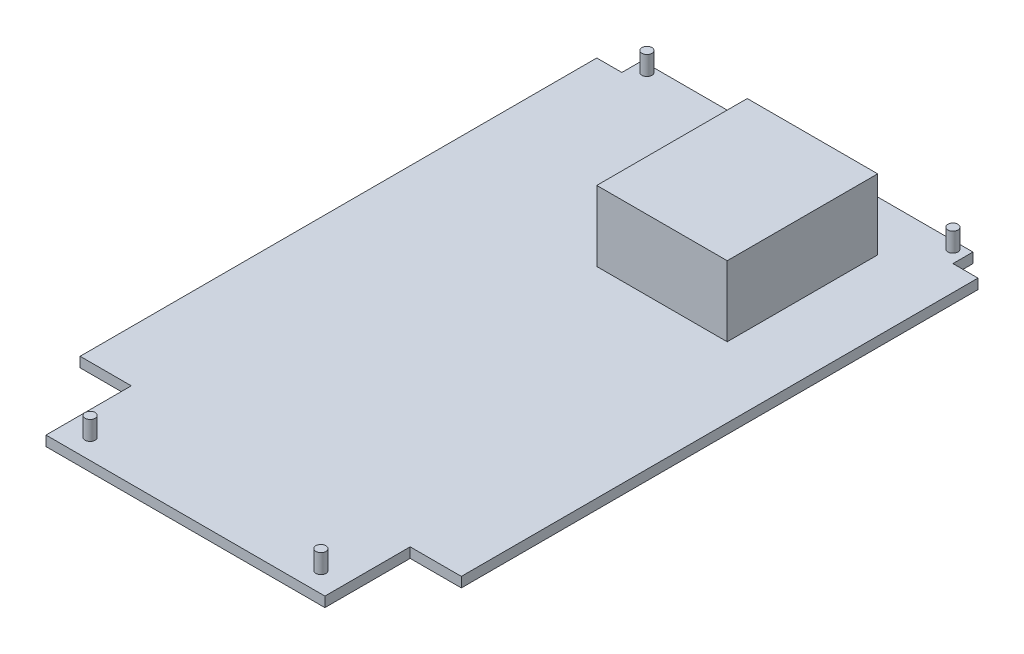
from build123d import *

# Parameters (mm, degrees)
BOSS_EXTRUDE1_DEPTH = 2
SKETCH2_R           = 1
BOSS_EXTRUDE2_DEPTH = 3.8
SKETCH3_W           = 26
SKETCH3_H           = 30
BOSS_EXTRUDE3_DEPTH = 16
SKETCH4_W           = 24
SKETCH4_H           = 28
CUT_EXTRUDE1_DEPTH  = 26
SKETCH5_W           = 28
SKETCH5_H           = 14
CUT_EXTRUDE2_DEPTH  = 1
SKETCH6_W           = 28
SKETCH6_H           = 1
BOSS_EXTRUDE4_DEPTH = 25


with BuildPart() as part:
    # Sketch1 → Boss-Extrude1 (new body)
    with BuildSketch(Plane(origin=(0, 0, 0), x_dir=(1, 0, 0), z_dir=(0, 1, 0))):
        Polygon((0, 0), (66, 0), (66, -4), (71, -4), (71, -107), (60.8, -107), (60.8, -115), (60.8, -124), (5.2, -124), (5.2, -115), (5.2, -107), (-5, -107), (-5, -4), (0, -4), align=None)
    extrude(amount=BOSS_EXTRUDE1_DEPTH)

    # Sketch2 → Boss-Extrude2 (add)
    with BuildSketch(Plane(origin=(0, 2, 0), x_dir=(1, 0, 0), z_dir=(0, 1, 0))):
        with Locations(Location((10, -120, 0), (0, 0, 90))):
            Circle(SKETCH2_R)
        with Locations(Location((56, -120, 0), (0, 0, 90))):
            Circle(SKETCH2_R)
        with Locations(Location((2.5, -1.5, 0), (0, 0, 90))):
            Circle(SKETCH2_R)
        with Locations(Location((63.5, -1.5, 0), (0, 0, 90))):
            Circle(SKETCH2_R)
    extrude(amount=BOSS_EXTRUDE2_DEPTH)

    # Sketch3 → Boss-Extrude3 (add)
    with BuildSketch(Plane(origin=(0, 0, 0), x_dir=(-1, 0, 0), z_dir=(0, -1, 0))):
        with Locations((-44, -25)):
            Rectangle(SKETCH3_W, SKETCH3_H)
    extrude(amount=-BOSS_EXTRUDE3_DEPTH)

    # Sketch4 → Cut-Extrude1 (cut)
    with BuildSketch(Plane(origin=(0, 16, 0), x_dir=(1, 0, 0), z_dir=(0, 1, 0))):
        with Locations((44, -25)):
            Rectangle(SKETCH4_W, SKETCH4_H)
    extrude(amount=-CUT_EXTRUDE1_DEPTH, mode=Mode.SUBTRACT)

    # Sketch5 → Cut-Extrude2 (cut)
    with BuildSketch(Plane(origin=(32, 0, 0), x_dir=(0, 0, -1), z_dir=(1, 0, 0))):
        with Locations((-25, 9)):
            Rectangle(SKETCH5_W, SKETCH5_H)
    extrude(amount=-CUT_EXTRUDE2_DEPTH, mode=Mode.SUBTRACT)

    # Sketch6 → Boss-Extrude4 (add)
    with BuildSketch(Plane.ZY.offset(-56)):
        with Locations((25, 15.5)):
            Rectangle(SKETCH6_W, SKETCH6_H)
    extrude(amount=BOSS_EXTRUDE4_DEPTH)


solid = part.part
